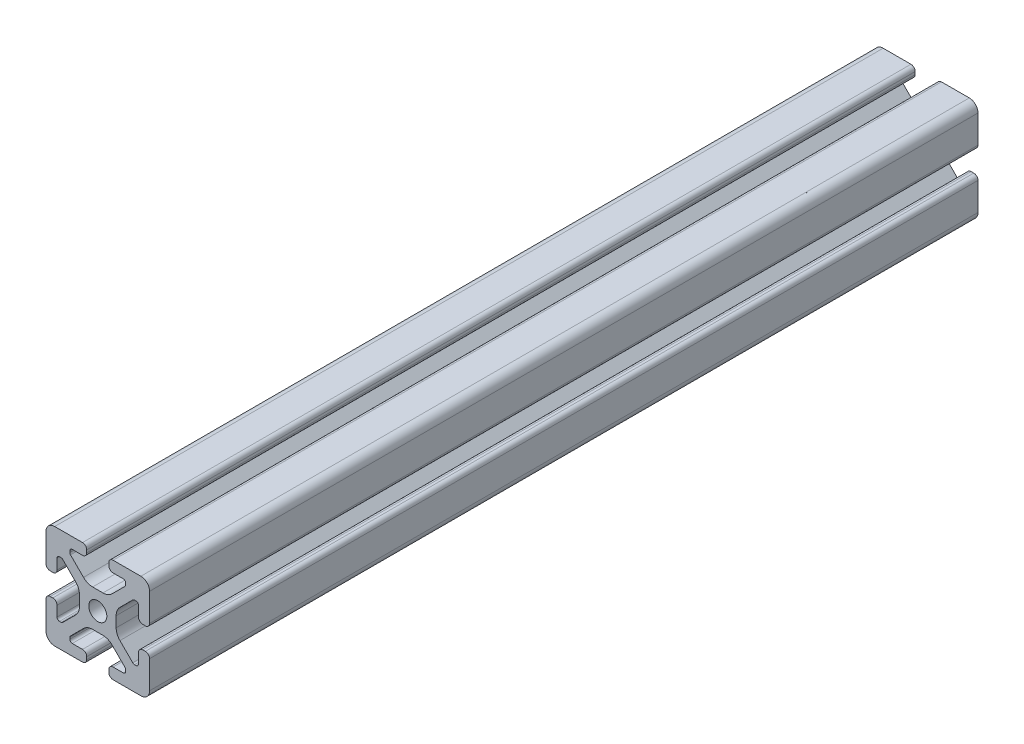
from build123d import *

# Parameters (mm, degrees)
BOSS_EXTRUDE1_DEPTH      = 152.4
BOSS_EXTRUDE1_DEPTH_BACK = 152.4
SKETCH3_R                = 3.3274


with BuildPart() as part:
    # Sketch3 → Boss-Extrude1 (new, two sides: drawn at the far end of the back side and taken through both)
    with BuildSketch(Plane.XY.offset(-BOSS_EXTRUDE1_DEPTH_BACK)):
        with BuildLine():
            ThreePointArc((-5.617617549, 14.986), (-4.519044045, 15.441044045), (-4.064, 16.539617549))
            Line((-4.064, 16.539617549), (-4.064, 17.496382451))
            ThreePointArc((-4.064, 17.496382451), (-4.519044045, 18.594955955), (-5.617617549, 19.05))
            Line((-5.617617549, 19.05), (-7.974178704, 19.05))
            Line((-7.974178704, 19.05), (-9.498178704, 19.05))
            Line((-9.498178704, 19.05), (-14.327719207, 19.05))
            Line((-14.327719207, 19.05), (-15.847487039, 19.05))
            ThreePointArc((-15.847487039, 19.05), (-18.120176289, 18.120192083), (-19.05, 15.847509295))
            Line((-19.05, 15.847509295), (-19.05, 14.327741484))
            Line((-19.05, 14.327741484), (-19.05, 9.496091471))
            Line((-19.05, 9.496091471), (-19.05, 7.97632366))
            Line((-19.05, 7.97632366), (-19.05, 5.617617549))
            ThreePointArc((-19.05, 5.617617549), (-18.594955955, 4.519044045), (-17.496382451, 4.064))
            Line((-17.496382451, 4.064), (-16.539617549, 4.064))
            ThreePointArc((-16.539617549, 4.064), (-15.441044045, 4.519044045), (-14.986, 5.617617549))
            Line((-14.986, 5.617617549), (-14.986, 9.385342516))
            ThreePointArc((-14.986, 9.385342516), (-14.721898185, 10.022940701), (-14.0843, 10.287042516))
            Line((-14.0843, 10.287042516), (-13.516042086, 10.287042516))
            ThreePointArc((-13.516042086, 10.287042516), (-13.170975923, 10.218404478), (-12.878443117, 10.022939917))
            Line((-12.878443117, 10.022939917), (-8.14758008, 5.292065243))
            ThreePointArc((-8.14758008, 5.292065243), (-7.117955879, 3.751120653), (-6.7564, 1.933453584))
            Line((-6.7564, 1.933453584), (-6.7564, -1.933453584))
            ThreePointArc((-6.7564, -1.933453584), (-7.117955879, -3.751120653), (-8.14758008, -5.292065243))
            Line((-8.14758008, -5.292065243), (-12.878443117, -10.022939917))
            ThreePointArc((-12.878443117, -10.022939917), (-13.170975923, -10.218404478), (-13.516042086, -10.287042516))
            Line((-13.516042086, -10.287042516), (-14.0843, -10.287042516))
            ThreePointArc((-14.0843, -10.287042516), (-14.721898185, -10.022940701), (-14.986, -9.385342516))
            Line((-14.986, -9.385342516), (-14.986, -5.617617549))
            ThreePointArc((-14.986, -5.617617549), (-15.441044045, -4.519044045), (-16.539617549, -4.064))
            Line((-16.539617549, -4.064), (-17.496382451, -4.064))
            ThreePointArc((-17.496382451, -4.064), (-18.594955955, -4.519044045), (-19.05, -5.617617549))
            Line((-19.05, -5.617617549), (-19.05, -7.976318491))
            Line((-19.05, -7.976318491), (-19.05, -9.496086302))
            Line((-19.05, -9.496086302), (-19.05, -14.32774291))
            Line((-19.05, -14.32774291), (-19.05, -15.847510721))
            ThreePointArc((-19.05, -15.847510721), (-18.120175716, -18.120192644), (-15.847486868, -19.05))
            Line((-15.847486868, -19.05), (-14.327719036, -19.05))
            Line((-14.327719036, -19.05), (-9.496062448, -19.05))
            Line((-9.496062448, -19.05), (-7.976294616, -19.05))
            Line((-7.976294616, -19.05), (-5.617617549, -19.05))
            ThreePointArc((-5.617617549, -19.05), (-4.519044045, -18.594955955), (-4.064, -17.496382451))
            Line((-4.064, -17.496382451), (-4.064, -16.539617549))
            ThreePointArc((-4.064, -16.539617549), (-4.519044045, -15.441044045), (-5.617617549, -14.986))
            Line((-5.617617549, -14.986), (-9.3853, -14.986))
            ThreePointArc((-9.3853, -14.986), (-10.022898185, -14.721898185), (-10.287, -14.0843))
            Line((-10.287, -14.0843), (-10.287, -13.552357131))
            ThreePointArc((-10.287, -13.552357131), (-10.218362387, -13.207291992), (-10.022898969, -12.91475973))
            Line((-10.022898969, -12.91475973), (-5.252158105, -8.144007132))
            ThreePointArc((-5.252158105, -8.144007132), (-3.715177372, -7.117027388), (-1.902183975, -6.7564))
            Line((-1.902183975, -6.7564), (1.902183975, -6.7564))
            ThreePointArc((1.902183975, -6.7564), (3.715177372, -7.117027388), (5.252158105, -8.144007132))
            Line((5.252158105, -8.144007132), (10.022898969, -12.91475973))
            ThreePointArc((10.022898969, -12.91475973), (10.218362387, -13.207291992), (10.287, -13.552357131))
            Line((10.287, -13.552357131), (10.287, -14.0843))
            ThreePointArc((10.287, -14.0843), (10.022898185, -14.721898185), (9.3853, -14.986))
            Line((9.3853, -14.986), (5.617617549, -14.986))
            ThreePointArc((5.617617549, -14.986), (4.519044045, -15.441044045), (4.064, -16.539617549))
            Line((4.064, -16.539617549), (4.064, -17.496382451))
            ThreePointArc((4.064, -17.496382451), (4.519044045, -18.594955955), (5.617617549, -19.05))
            Line((5.617617549, -19.05), (7.976294616, -19.05))
            Line((7.976294616, -19.05), (9.496062448, -19.05))
            Line((9.496062448, -19.05), (14.327719036, -19.05))
            Line((14.327719036, -19.05), (15.847486868, -19.05))
            ThreePointArc((15.847486868, -19.05), (18.120175716, -18.120192644), (19.05, -15.847510721))
            Line((19.05, -15.847510721), (19.05, -14.32774291))
            Line((19.05, -14.32774291), (19.05, -9.496086302))
            Line((19.05, -9.496086302), (19.05, -7.976318491))
            Line((19.05, -7.976318491), (19.05, -5.617617549))
            ThreePointArc((19.05, -5.617617549), (18.594955955, -4.519044045), (17.496382451, -4.064))
            Line((17.496382451, -4.064), (16.539617549, -4.064))
            ThreePointArc((16.539617549, -4.064), (15.441044045, -4.519044045), (14.986, -5.617617549))
            Line((14.986, -5.617617549), (14.986, -9.385342516))
            ThreePointArc((14.986, -9.385342516), (14.721898185, -10.022940701), (14.0843, -10.287042516))
            Line((14.0843, -10.287042516), (13.516042086, -10.287042516))
            ThreePointArc((13.516042086, -10.287042516), (13.170975923, -10.218404478), (12.878443117, -10.022939917))
            Line((12.878443117, -10.022939917), (8.14758008, -5.292065243))
            ThreePointArc((8.14758008, -5.292065243), (7.117955879, -3.751120653), (6.7564, -1.933453584))
            Line((6.7564, -1.933453584), (6.7564, 1.933453584))
            ThreePointArc((6.7564, 1.933453584), (7.117955879, 3.751120653), (8.14758008, 5.292065243))
            Line((8.14758008, 5.292065243), (12.878443117, 10.022939917))
            ThreePointArc((12.878443117, 10.022939917), (13.170975923, 10.218404478), (13.516042086, 10.287042516))
            Line((13.516042086, 10.287042516), (14.0843, 10.287042516))
            ThreePointArc((14.0843, 10.287042516), (14.721898185, 10.022940701), (14.986, 9.385342516))
            Line((14.986, 9.385342516), (14.986, 5.617617549))
            ThreePointArc((14.986, 5.617617549), (15.441044045, 4.519044045), (16.539617549, 4.064))
            Line((16.539617549, 4.064), (17.496382451, 4.064))
            ThreePointArc((17.496382451, 4.064), (18.594955955, 4.519044045), (19.05, 5.617617549))
            Line((19.05, 5.617617549), (19.05, 7.97632366))
            Line((19.05, 7.97632366), (19.05, 9.496091471))
            Line((19.05, 9.496091471), (19.05, 14.327741484))
            Line((19.05, 14.327741484), (19.05, 15.847509295))
            ThreePointArc((19.05, 15.847509295), (18.120176289, 18.120192083), (15.847487039, 19.05))
            Line((15.847487039, 19.05), (14.327719207, 19.05))
            Line((14.327719207, 19.05), (9.498178704, 19.05))
            Line((9.498178704, 19.05), (7.974178704, 19.05))
            Line((7.974178704, 19.05), (5.617617549, 19.05))
            ThreePointArc((5.617617549, 19.05), (4.519044045, 18.594955955), (4.064, 17.496382451))
            Line((4.064, 17.496382451), (4.064, 16.539617549))
            ThreePointArc((4.064, 16.539617549), (4.519044045, 15.441044045), (5.617617549, 14.986))
            Line((5.617617549, 14.986), (9.3853, 14.986))
            ThreePointArc((9.3853, 14.986), (10.022898185, 14.721898185), (10.287, 14.0843))
            Line((10.287, 14.0843), (10.287, 13.552357131))
            ThreePointArc((10.287, 13.552357131), (10.218362387, 13.207291992), (10.022898969, 12.91475973))
            Line((10.022898969, 12.91475973), (5.252158105, 8.144007132))
            ThreePointArc((5.252158105, 8.144007132), (3.715177372, 7.117027388), (1.902183975, 6.7564))
            Line((1.902183975, 6.7564), (-1.902183975, 6.7564))
            ThreePointArc((-1.902183975, 6.7564), (-3.715177372, 7.117027388), (-5.252158105, 8.144007132))
            Line((-5.252158105, 8.144007132), (-10.022898969, 12.91475973))
            ThreePointArc((-10.022898969, 12.91475973), (-10.218362387, 13.207291992), (-10.287, 13.552357131))
            Line((-10.287, 13.552357131), (-10.287, 14.0843))
            ThreePointArc((-10.287, 14.0843), (-10.022898185, 14.721898185), (-9.3853, 14.986))
            Line((-9.3853, 14.986), (-5.617617549, 14.986))
        make_face()
        Circle(SKETCH3_R, mode=Mode.SUBTRACT)
    extrude(amount=BOSS_EXTRUDE1_DEPTH + BOSS_EXTRUDE1_DEPTH_BACK)


solid = part.part
